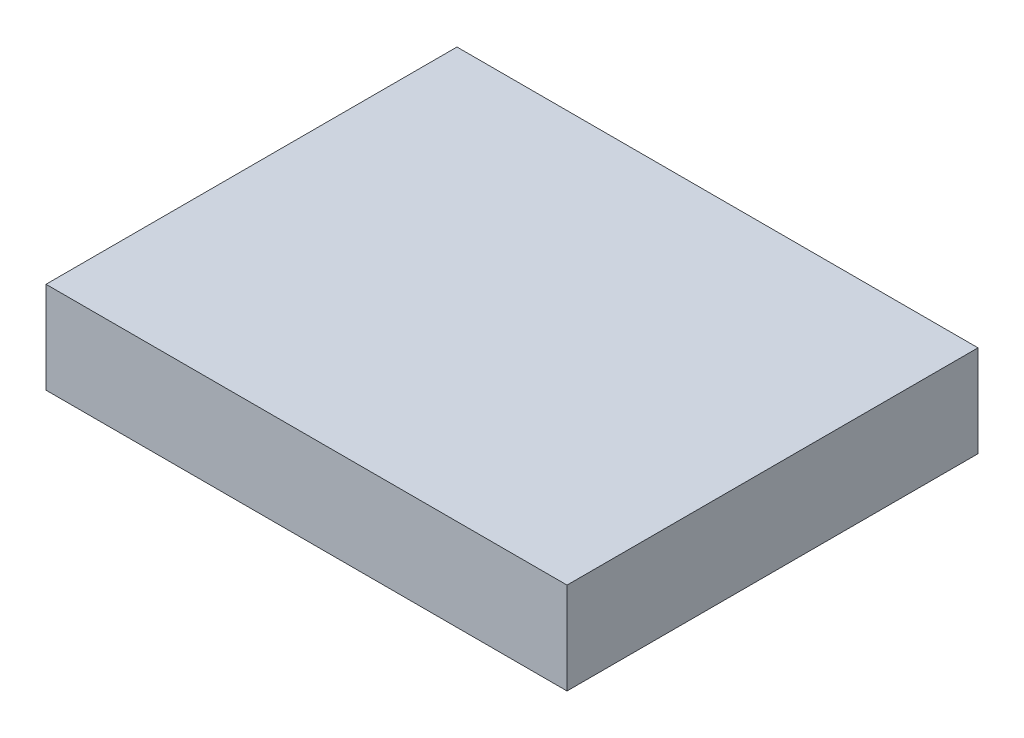
from build123d import *

# Parameters (mm, degrees)
SKETCH1_W           = 71
SKETCH1_H           = 56
BOSS_EXTRUDE1_DEPTH = 12.5


with BuildPart() as part:
    # Sketch1 → Boss-Extrude1 (new body)
    with BuildSketch(Plane(origin=(0, 0, 0), x_dir=(1, 0, 0), z_dir=(0, 1, 0))):
        with Locations((35.5, 28)):
            Rectangle(SKETCH1_W, SKETCH1_H)
    extrude(amount=BOSS_EXTRUDE1_DEPTH)


solid = part.part
